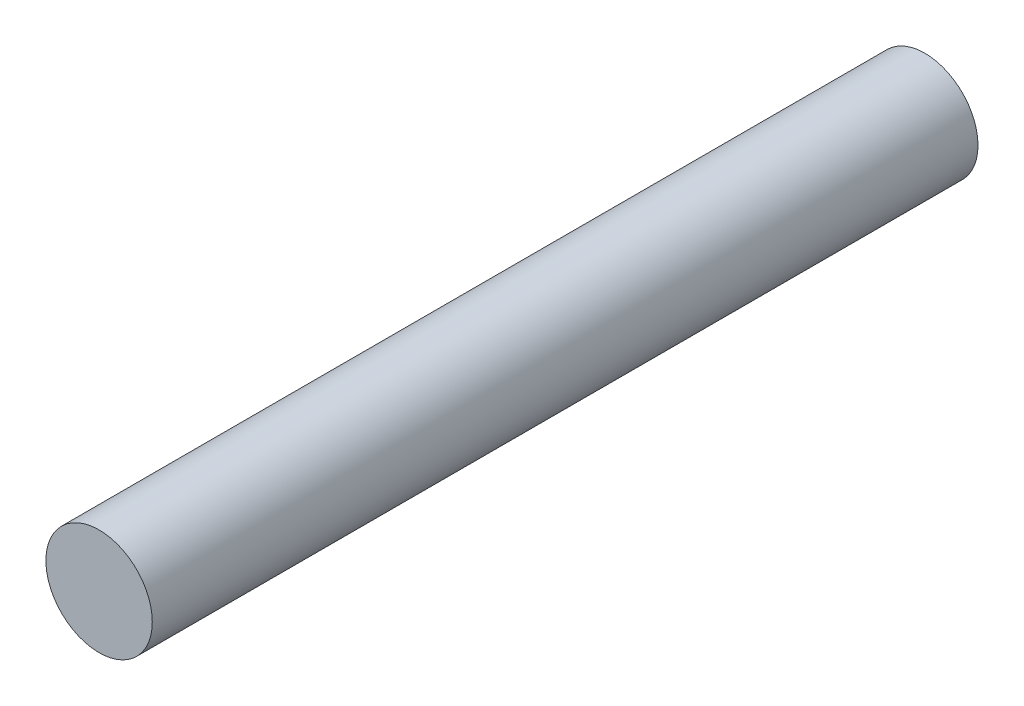
from build123d import *

# Parameters (mm, degrees)
SKETCH1_R           = 4
BOSS_EXTRUDE3_DEPTH = 62.1


with BuildPart() as part:
    # Sketch1 → Boss-Extrude3 (new body)
    with BuildSketch(Plane.XY):
        Circle(SKETCH1_R)
    extrude(amount=BOSS_EXTRUDE3_DEPTH)


solid = part.part
